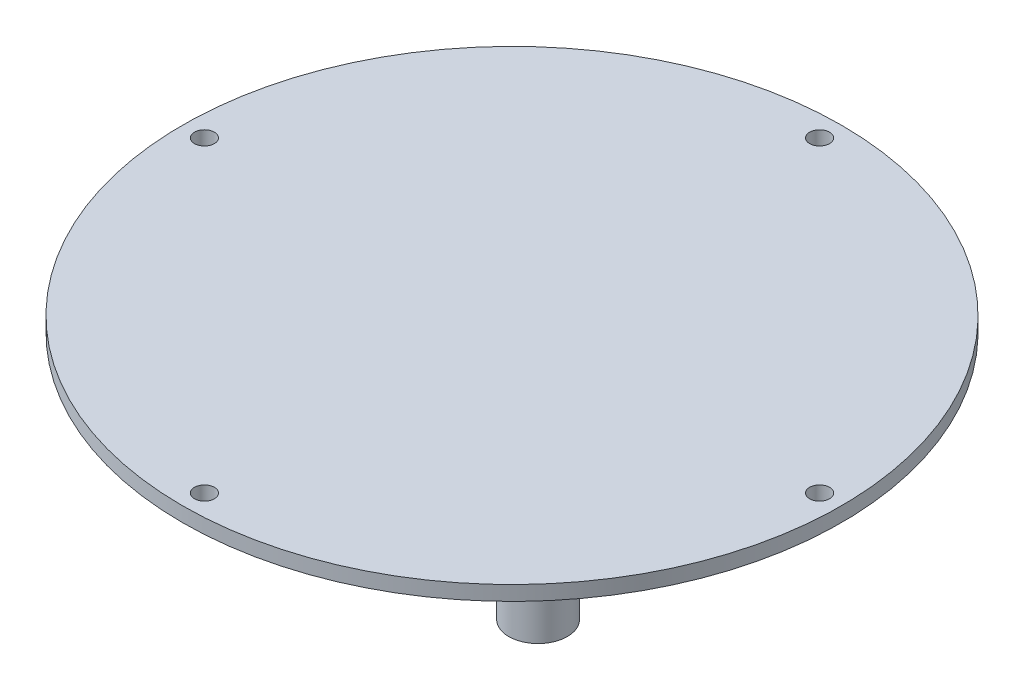
from build123d import *

# Parameters (mm, degrees)
SKETCH2_R             = 57.15
BOSS_EXTRUDE1_DEPTH   = 2.54
SKETCH3_R             = 5.08
BOSS_EXTRUDE2_DEPTH   = 12.7
CIRPATTERN1_COUNT     = 4
F_8_32_TAPPED_HOLE1_D = 3.4544
CIRPATTERN2_COUNT     = 4


with BuildPart() as part:
    # Sketch2 → Boss-Extrude1 (new body)
    with BuildSketch(Plane(origin=(0, 0, 0), x_dir=(1, 0, 0), z_dir=(0, 1, 0))):
        with Locations(Location((0, 0, 0), (0, 0, 270))):
            Circle(SKETCH2_R)
    extrude(amount=BOSS_EXTRUDE1_DEPTH)

    # Sketch3 → Boss-Extrude2 (add)
    with BuildSketch(Plane.XZ):
        with Locations(Location((-32.710383859, -28.187642467, 0), (0, 0, 90))):
            Circle(SKETCH3_R)
    boss_extrude2 = extrude(amount=BOSS_EXTRUDE2_DEPTH)

    # CirPattern1: Boss-Extrude2 ×4 about axis
    cirpattern1_axis = Axis((0, 0, 0), (0, 1, 0))
    for i in range(1, CIRPATTERN1_COUNT):
        add(boss_extrude2.rotate(cirpattern1_axis, i * 360 / CIRPATTERN1_COUNT))

    # #8-32 Tapped Hole1 (through all)
    with Locations(Plane(origin=(0, 2.54, 0), x_dir=(1, 0, 0), z_dir=(0, 1, 0))):
        with Locations((-53.34, 0)):
            f_8_32_tapped_hole1 = Hole(F_8_32_TAPPED_HOLE1_D / 2)

    # CirPattern2: #8-32 Tapped Hole1 ×4 about axis
    cirpattern2_axis = Axis((0, 0, 0), (0, 1, 0))
    for i in range(1, CIRPATTERN2_COUNT):
        add(f_8_32_tapped_hole1.rotate(cirpattern2_axis, i * 360 / CIRPATTERN2_COUNT), mode=Mode.SUBTRACT)


solid = part.part
